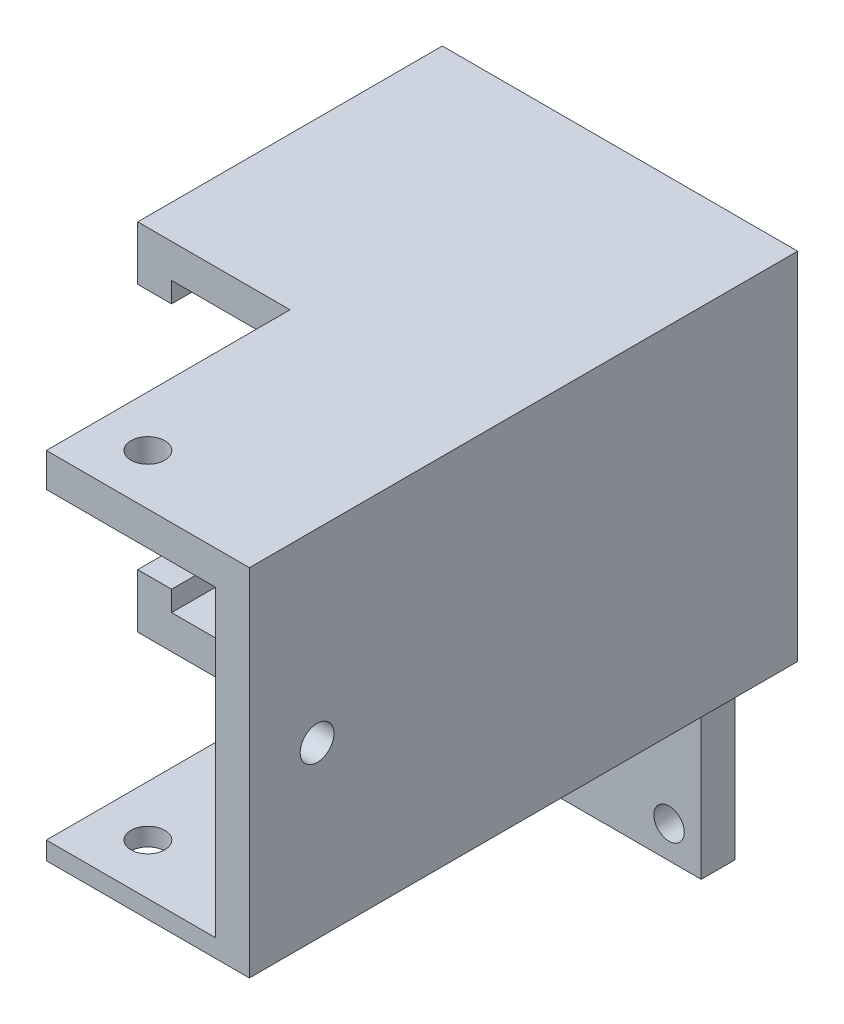
from build123d import *

# Parameters (mm, degrees)
SKETCH1_R               = 2.25
BOSS_EXTRUDE1_DEPTH     = 5
SKETCH2_W               = 52.5
SKETCH2_H               = 52.5
SKETCH2_W_2             = 42.5
SKETCH2_H_2             = 42.5
BOSS_EXTRUDE2_DEPTH     = 40
BOSS_EXTRUDE3_DEPTH     = 36
CUT_EXTRUDE2_DEPTH      = 121.157448791
CUT_EXTRUDE2_DEPTH_BACK = 121.157448791
SKETCH6_R               = 2.5
CUT_EXTRUDE3_DEPTH      = 127.97834461
CUT_EXTRUDE3_DEPTH_BACK = 127.97834461
SKETCH7_R               = 2.5
SKETCH8_W               = 40
SKETCH8_H               = 36.5
CUT_EXTRUDE4_DEPTH      = 24
SKETCH9_W               = 25
SKETCH9_H               = 25.519409936
CUT_EXTRUDE5_DEPTH      = 2.35


with BuildPart() as part:
    # Sketch1 → Boss-Extrude1 (new body)
    with BuildSketch(Plane.XY):
        Polygon((0, 30), (-9.25, 30), (-9.25, 82.5), (43.25, 82.5), (43.25, 30), (34, 30), (34, 0), (0, 0), align=None)
        with Locations((4.75, 25.25)):
            Circle(SKETCH1_R, mode=Mode.SUBTRACT)
        with Locations((29.25, 25.25)):
            Circle(SKETCH1_R, mode=Mode.SUBTRACT)
        with Locations((29.25, 4.75)):
            Circle(SKETCH1_R, mode=Mode.SUBTRACT)
        with Locations((4.75, 4.75)):
            Circle(SKETCH1_R, mode=Mode.SUBTRACT)
    extrude(amount=BOSS_EXTRUDE1_DEPTH)

    # Sketch2 → Boss-Extrude2 (add)
    with BuildSketch(Plane.XY.offset(5)):
        with Locations((17, 56.25)):
            Rectangle(SKETCH2_W, SKETCH2_H)
        with Locations((17, 56.25)):
            Rectangle(SKETCH2_W_2, SKETCH2_H_2, mode=Mode.SUBTRACT)
    extrude(amount=BOSS_EXTRUDE2_DEPTH)

    # Sketch5 → Boss-Extrude3 (add)
    with BuildSketch(Plane.XY.offset(45)):
        Polygon((43.25, 82.5), (43.25, 30), (13.25, 30), (13.25, 35), (38.25, 35), (38.25, 77.5), (13.25, 77.5), (13.25, 82.5), align=None)
    extrude(amount=BOSS_EXTRUDE3_DEPTH)

    # Sketch6 → Cut-Extrude2 (cut, two sides: drawn at the far end of the back side and taken through both)
    with BuildSketch(Plane.XZ.offset(-77.5).offset(-CUT_EXTRUDE2_DEPTH_BACK)):
        with Locations(Location((20.75, 73.5, 0), (0, 0, 270))):
            Circle(SKETCH6_R)
    extrude(amount=CUT_EXTRUDE2_DEPTH + CUT_EXTRUDE2_DEPTH_BACK, mode=Mode.SUBTRACT)

    # Sketch7 → Cut-Extrude3 (cut, two sides: drawn at the far end of the back side and taken through both)
    with BuildSketch(Plane(origin=(43.25, 0, 0), x_dir=(0, 0, -1), z_dir=(1, 0, 0)).offset(-CUT_EXTRUDE3_DEPTH_BACK)):
        with Locations(Location((-71, 55.075, 0), (0, 0, 90))):
            Circle(SKETCH7_R)
    extrude(amount=CUT_EXTRUDE3_DEPTH + CUT_EXTRUDE3_DEPTH_BACK, mode=Mode.SUBTRACT)

    # Sketch8 → Cut-Extrude4 (cut)
    with BuildSketch(Plane.ZY.offset(9.25)):
        with Locations((25, 56.25)):
            Rectangle(SKETCH8_W, SKETCH8_H)
    extrude(amount=-CUT_EXTRUDE4_DEPTH, mode=Mode.SUBTRACT)

    # Sketch9 → Cut-Extrude5 (cut)
    with BuildSketch(Plane(origin=(0, 35, 0), x_dir=(1, 0, 0), z_dir=(0, 1, 0))):
        with Locations((25.75, -68.240295032)):
            Rectangle(SKETCH9_W, SKETCH9_H)
    extrude(amount=-CUT_EXTRUDE5_DEPTH, mode=Mode.SUBTRACT)


solid = part.part
